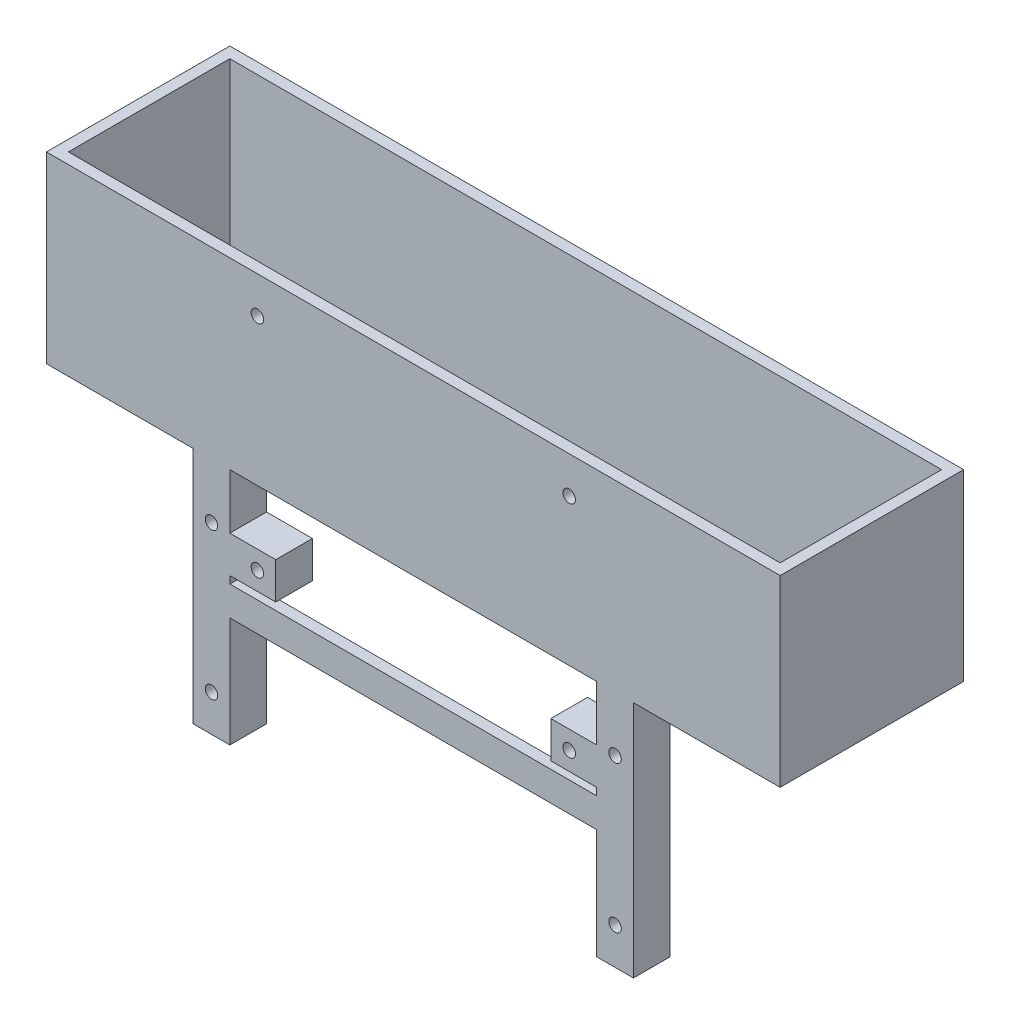
from build123d import *

# Parameters (mm, degrees)
BOX_FOOTPRINT_200_X_50_MM_W                      = 200
BOX_FOOTPRINT_200_X_50_MM_H                      = 50
BOX_HEIGHT_50_MM_DEPTH                           = 50
REAR_OPENING_194_X_44_MM_W                       = 194
REAR_OPENING_194_X_44_MM_H                       = 44
REAR_CAVITY_WALL_3_MM_DEPTH                      = 47
CHASSIS_FACE_OPENINGS_AND_MOUNTING_CROSS_W       = 37
CHASSIS_FACE_OPENINGS_AND_MOUNTING_CROSS_H       = 44
CHASSIS_FACE_OPENINGS_AND_MOUNTING_CROSS_W_2     = 100
CHASSIS_FACE_OPENINGS_AND_MOUNTING_CROSS_H_2     = 13
OPEN_FRONT_MOUNTING_FRAME_DEPTH                  = 3
PHOTO_RAILS_10_X_10_PITCH_110_PROVISIONA_W       = 10
PHOTO_RAILS_10_X_10_PITCH_110_PROVISIONA_H       = 10
TWO_FORWARD_RAILS_65_MM_PROVISIONAL_DEPTH        = 65
LEFT_INWARD_PCB_MOUNTING_EAR_W                   = 10
LEFT_INWARD_PCB_MOUNTING_EAR_H                   = 10
LEFT_PCB_EAR_12_5_MM_DEPTH                       = 12.5
RIGHT_INWARD_PCB_MOUNTING_EAR_W                  = 10
RIGHT_INWARD_PCB_MOUNTING_EAR_H                  = 10
RIGHT_PCB_EAR_12_5_MM_DEPTH                      = 12.5
OPEN_FRAME_TRANSVERSE_BRACE_8_X_3_MM_W           = 3
OPEN_FRAME_TRANSVERSE_BRACE_8_X_3_MM_H           = 8
TRANSVERSE_FRAME_BRACE_DEPTH                     = 100
F_4X_VERTICAL_SLOTS_3_4_X_10_MM_DEPTH            = 3
PCB_REAR_HOLES_PITCH_85_MM_R                     = 1.7
PCB_ROOF_HOLES_DIAMETER_3_4_MM_DEPTH             = 3
PCB_FRONT_HOLES_ROW_SPACING_60_MM_R              = 1.7
PCB_EAR_HOLES_DIAMETER_3_4_MM_DEPTH              = 10
CHASSIS_TOP_HOLES_110_X_40_PROVISIONAL_R         = 1.7
F_4X_RAIL_HOLES_THROUGH_UPPER_AND_LOWER_FA_DEPTH = 10


with BuildPart() as part:
    # Box footprint 200 x 50 mm → Box height 50 mm (new body)
    with BuildSketch(Plane.XY):
        with Locations((0, 25)):
            Rectangle(BOX_FOOTPRINT_200_X_50_MM_W, BOX_FOOTPRINT_200_X_50_MM_H)
    extrude(amount=BOX_HEIGHT_50_MM_DEPTH)

    # Rear opening 194 x 44 mm → Rear cavity wall 3 mm (cut)
    with BuildSketch(Plane(origin=(0, 50, 0), x_dir=(1, 0, 0), z_dir=(0, 1, 0))):
        with Locations((0, -25)):
            Rectangle(REAR_OPENING_194_X_44_MM_W, REAR_OPENING_194_X_44_MM_H)
    extrude(amount=-REAR_CAVITY_WALL_3_MM_DEPTH, mode=Mode.SUBTRACT)

    # Chassis face openings and mounting crossbar → Open front mounting frame (cut)
    with BuildSketch(Plane.XZ):
        with Locations((-78.5, 25)):
            Rectangle(CHASSIS_FACE_OPENINGS_AND_MOUNTING_CROSS_W, CHASSIS_FACE_OPENINGS_AND_MOUNTING_CROSS_H)
        with Locations((78.5, 25)):
            Rectangle(CHASSIS_FACE_OPENINGS_AND_MOUNTING_CROSS_W, CHASSIS_FACE_OPENINGS_AND_MOUNTING_CROSS_H)
        with Locations((0, 9.5)):
            Rectangle(CHASSIS_FACE_OPENINGS_AND_MOUNTING_CROSS_W_2, CHASSIS_FACE_OPENINGS_AND_MOUNTING_CROSS_H_2)
        with Locations((0, 40.5)):
            Rectangle(CHASSIS_FACE_OPENINGS_AND_MOUNTING_CROSS_W_2, CHASSIS_FACE_OPENINGS_AND_MOUNTING_CROSS_H_2)
    extrude(amount=-OPEN_FRONT_MOUNTING_FRAME_DEPTH, mode=Mode.SUBTRACT)

    # Photo rails 10 x 10 pitch 110 provisional → Two forward rails 65 mm provisional (add)
    with BuildSketch(Plane.XZ):
        with Locations((-55, 45)):
            Rectangle(PHOTO_RAILS_10_X_10_PITCH_110_PROVISIONA_W, PHOTO_RAILS_10_X_10_PITCH_110_PROVISIONA_H)
        with Locations((55, 45)):
            Rectangle(PHOTO_RAILS_10_X_10_PITCH_110_PROVISIONA_W, PHOTO_RAILS_10_X_10_PITCH_110_PROVISIONA_H)
    extrude(amount=TWO_FORWARD_RAILS_65_MM_PROVISIONAL_DEPTH)

    # Left inward PCB mounting ear → Left PCB ear 12.5 mm (add)
    with BuildSketch(Plane(origin=(-50, 0, 0), x_dir=(0, 0, -1), z_dir=(1, 0, 0))):
        with Locations((-45, -20)):
            Rectangle(LEFT_INWARD_PCB_MOUNTING_EAR_W, LEFT_INWARD_PCB_MOUNTING_EAR_H)
    extrude(amount=LEFT_PCB_EAR_12_5_MM_DEPTH)

    # Right inward PCB mounting ear → Right PCB ear 12.5 mm (add)
    with BuildSketch(Plane.ZY.offset(-50)):
        with Locations((45, -20)):
            Rectangle(RIGHT_INWARD_PCB_MOUNTING_EAR_W, RIGHT_INWARD_PCB_MOUNTING_EAR_H)
    extrude(amount=RIGHT_PCB_EAR_12_5_MM_DEPTH)

    # Open frame transverse brace 8 x 3 mm → Transverse frame brace (add)
    with BuildSketch(Plane(origin=(-50, 0, 0), x_dir=(0, 0, -1), z_dir=(1, 0, 0))):
        with Locations((-48.5, -31)):
            Rectangle(OPEN_FRAME_TRANSVERSE_BRACE_8_X_3_MM_W, OPEN_FRAME_TRANSVERSE_BRACE_8_X_3_MM_H)
    extrude(amount=TRANSVERSE_FRAME_BRACE_DEPTH)

    # Chassis slot centers -50 -20 20 50 mm → 4x vertical slots 3.4 x 10 mm (cut)
    with BuildSketch(Plane.XZ):
        with BuildLine():
            Line((-51.7, 21.7), (-51.7, 28.3))
            ThreePointArc((-51.7, 28.3), (-50, 30), (-48.3, 28.3))
            Line((-48.3, 28.3), (-48.3, 21.7))
            ThreePointArc((-48.3, 21.7), (-50, 20), (-51.7, 21.7))
        make_face()
        with BuildLine():
            Line((-21.7, 21.7), (-21.7, 28.3))
            ThreePointArc((-21.7, 28.3), (-20, 30), (-18.3, 28.3))
            Line((-18.3, 28.3), (-18.3, 21.7))
            ThreePointArc((-18.3, 21.7), (-20, 20), (-21.7, 21.7))
        make_face()
        with BuildLine():
            Line((18.3, 21.7), (18.3, 28.3))
            ThreePointArc((18.3, 28.3), (20, 30), (21.7, 28.3))
            Line((21.7, 28.3), (21.7, 21.7))
            ThreePointArc((21.7, 21.7), (20, 20), (18.3, 21.7))
        make_face()
        with BuildLine():
            Line((48.3, 21.7), (48.3, 28.3))
            ThreePointArc((48.3, 28.3), (50, 30), (51.7, 28.3))
            Line((51.7, 28.3), (51.7, 21.7))
            ThreePointArc((51.7, 21.7), (50, 20), (48.3, 21.7))
        make_face()
    extrude(amount=-F_4X_VERTICAL_SLOTS_3_4_X_10_MM_DEPTH, mode=Mode.SUBTRACT)

    # PCB rear holes pitch 85 mm → PCB roof holes diameter 3.4 mm (cut)
    with BuildSketch(Plane.XY.offset(50)):
        with Locations((-42.5, 40)):
            Circle(PCB_REAR_HOLES_PITCH_85_MM_R)
        with Locations((42.5, 40)):
            Circle(PCB_REAR_HOLES_PITCH_85_MM_R)
    extrude(amount=-PCB_ROOF_HOLES_DIAMETER_3_4_MM_DEPTH, mode=Mode.SUBTRACT)

    # PCB front holes row spacing 60 mm → PCB ear holes diameter 3.4 mm (cut)
    with BuildSketch(Plane.XY.offset(50)):
        with Locations((-42.5, -20)):
            Circle(PCB_FRONT_HOLES_ROW_SPACING_60_MM_R)
        with Locations((42.5, -20)):
            Circle(PCB_FRONT_HOLES_ROW_SPACING_60_MM_R)
    extrude(amount=-PCB_EAR_HOLES_DIAMETER_3_4_MM_DEPTH, mode=Mode.SUBTRACT)

    # Chassis top holes 110 x 40 provisional → 4x rail holes through upper and lower faces (cut)
    with BuildSketch(Plane.XY.offset(50)):
        with Locations((-55, -55)):
            Circle(CHASSIS_TOP_HOLES_110_X_40_PROVISIONAL_R)
        with Locations((-55, -15)):
            Circle(CHASSIS_TOP_HOLES_110_X_40_PROVISIONAL_R)
        with Locations((55, -55)):
            Circle(CHASSIS_TOP_HOLES_110_X_40_PROVISIONAL_R)
        with Locations((55, -15)):
            Circle(CHASSIS_TOP_HOLES_110_X_40_PROVISIONAL_R)
    extrude(amount=-F_4X_RAIL_HOLES_THROUGH_UPPER_AND_LOWER_FA_DEPTH, mode=Mode.SUBTRACT)


solid = part.part
